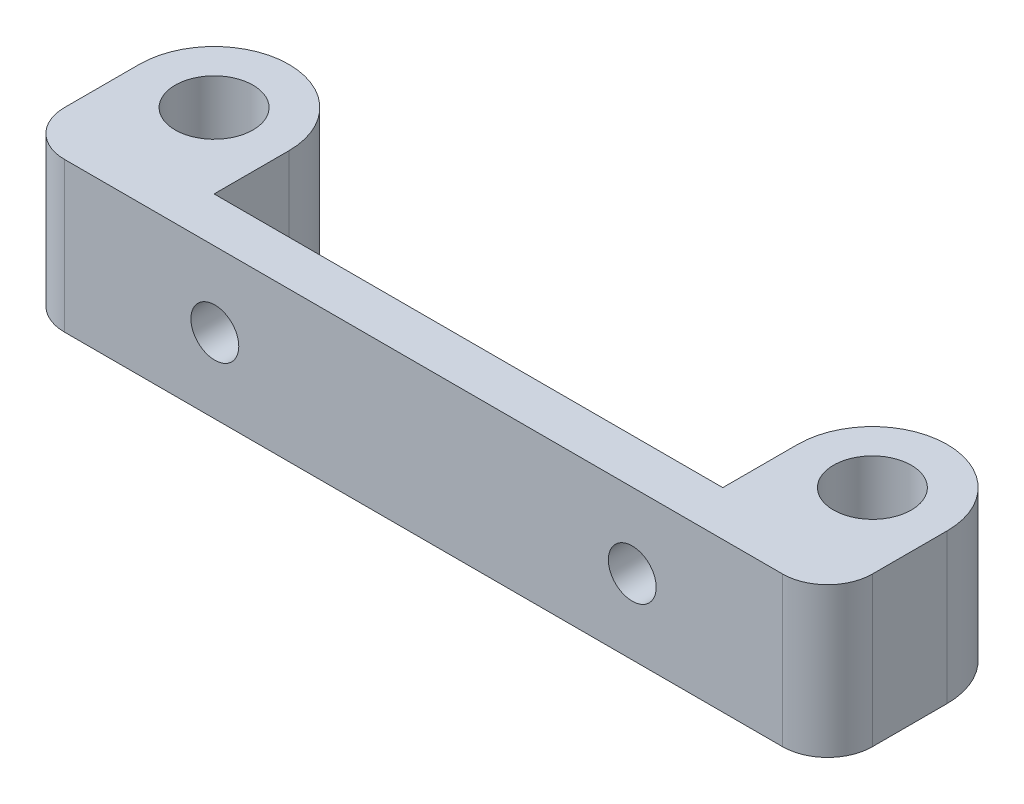
from build123d import *

# Parameters (mm, degrees)
EXTRUDE_1_DEPTH = 3
SKETCH_2_R      = 5
SKETCH_2_R_2    = 2.6
EXTRUDE_2_DEPTH = 10
FILLET_1_R      = 3


with BuildPart() as part:
    # 草图1 → 凸台-拉伸1 (new body)
    with BuildSketch(Plane.XY):
        with BuildLine():
            Line((0, 5), (-13.95, 5))
            Line((-13.95, 5), (-13.95, 1.6))
            ThreePointArc((-13.95, 1.6), (-12.81862915, 1.13137085), (-12.35, 0))
            Line((-12.35, 0), (0, 0))
            Line((0, 0), (0, 5))
        make_face()
        with BuildLine():
            Line((-27, 5), (-27, 0))
            Line((-27, 0), (-17, 0))
            Line((-17, 0), (-15.55, 0))
            ThreePointArc((-15.55, 0), (-15.08137085, 1.13137085), (-13.95, 1.6))
            Line((-13.95, 1.6), (-13.95, 5))
            Line((-13.95, 5), (-27, 5))
        make_face()
        with BuildLine():
            Line((-17, 0), (-27, 0))
            Line((-27, 0), (-27, -5))
            Line((-27, -5), (27, -5))
            Line((27, -5), (27, 0))
            Line((27, 0), (17, 0))
            Line((17, 0), (15.55, 0))
            ThreePointArc((15.55, 0), (13.95, -1.6), (12.35, 0))
            Line((12.35, 0), (0, 0))
            Line((0, 0), (-12.35, 0))
            ThreePointArc((-12.35, 0), (-13.95, -1.6), (-15.55, 0))
            Line((-15.55, 0), (-17, 0))
        make_face()
        with BuildLine():
            Line((17, 0), (27, 0))
            Line((27, 0), (27, 5))
            Line((27, 5), (0, 5))
            Line((0, 5), (0, 0))
            Line((0, 0), (12.35, 0))
            ThreePointArc((12.35, 0), (13.95, 1.6), (15.55, 0))
            Line((15.55, 0), (17, 0))
        make_face()
    extrude(amount=EXTRUDE_1_DEPTH)

    # 草图2 → 凸台-拉伸2 (add, through all)
    # profile 1 of 6: a face of its own
    with BuildSketch(Plane(origin=(0, 5, 0), x_dir=(1, 0, 0), z_dir=(0, 1, 0))):
        with Locations((-22, 5)):
            Circle(SKETCH_2_R)
        with Locations(Location((-22, 5, 0), (0, 0, 270))):
            Circle(SKETCH_2_R_2, mode=Mode.SUBTRACT)
    # profile 2 of 6: a face of its own
    with BuildSketch(Plane(origin=(0, 5, 0), x_dir=(1, 0, 0), z_dir=(0, 1, 0))):
        with BuildLine():
            Line((-17, 0), (-17, 5))
            ThreePointArc((-17, 5), (-18.464466102, 1.464466086), (-22.000000023, 0))
            Line((-22.000000023, 0), (-17, 0))
        make_face()
    # profile 3 of 6: a face of its own
    with BuildSketch(Plane(origin=(0, 5, 0), x_dir=(1, 0, 0), z_dir=(0, 1, 0))):
        with BuildLine():
            ThreePointArc((-22.000000023, 0), (-25.535533914, 1.464466102), (-27, 5))
            Line((-27, 5), (-27, 0))
            Line((-27, 0), (-22.000000023, 0))
        make_face()
    # profile 4 of 6: a face of its own
    with BuildSketch(Plane(origin=(0, 5, 0), x_dir=(1, 0, 0), z_dir=(0, 1, 0))):
        with BuildLine():
            Line((17, 5), (17, 0))
            Line((17, 0), (22, 0))
            ThreePointArc((22, 0), (18.464466094, 1.464466094), (17, 5))
        make_face()
    # profile 5 of 6: a face of its own
    with BuildSketch(Plane(origin=(0, 5, 0), x_dir=(1, 0, 0), z_dir=(0, 1, 0))):
        with Locations((22, 5)):
            Circle(SKETCH_2_R)
        with Locations(Location((22, 5, 0), (0, 0, 270))):
            Circle(SKETCH_2_R_2, mode=Mode.SUBTRACT)
    # profile 6 of 6: a face of its own
    with BuildSketch(Plane(origin=(0, 5, 0), x_dir=(1, 0, 0), z_dir=(0, 1, 0))):
        with BuildLine():
            ThreePointArc((27, 5), (25.535533906, 1.464466094), (22, 0))
            Line((22, 0), (27, 0))
            Line((27, 0), (27, 5))
        make_face()
    extrude(amount=-EXTRUDE_2_DEPTH)

    # 圆角1
    fillet_1_edges = [part.edges().sort_by_distance(p)[0] for p in [
        (27, 0, 3),
        (-27, 0, 3),
    ]]
    fillet(fillet_1_edges, radius=FILLET_1_R)


solid = part.part
